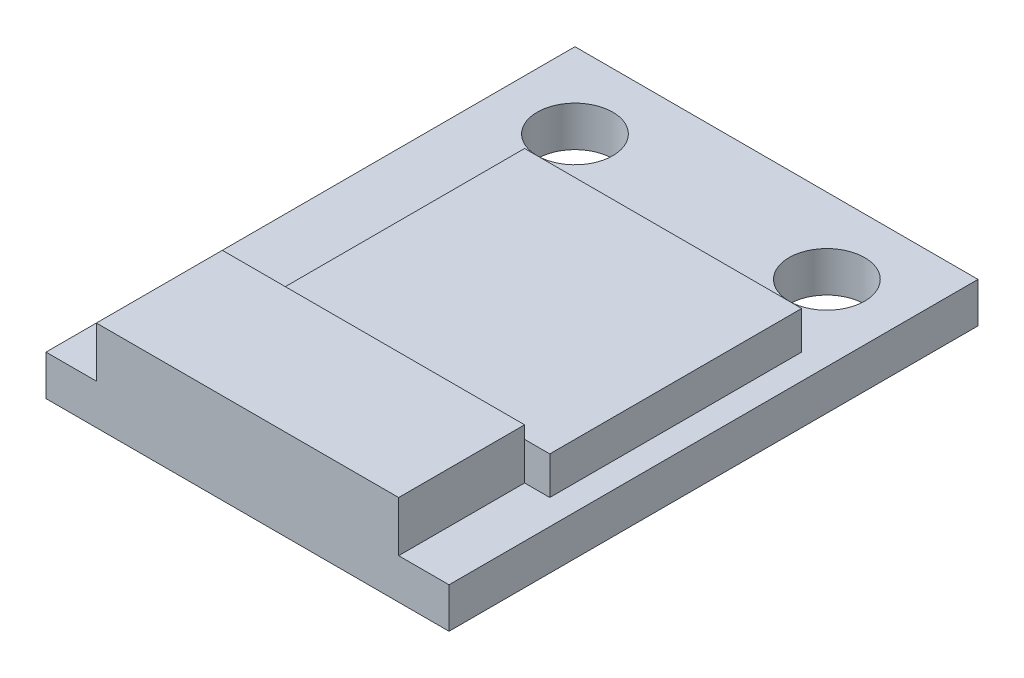
from build123d import *

# Parameters (mm, degrees)
SKETCH1_W           = 16
SKETCH1_H           = 21
SKETCH1_R           = 1.5
BOSS_EXTRUDE1_DEPTH = 1.6
SKETCH2_W           = 11
SKETCH2_H           = 10
BOSS_EXTRUDE2_DEPTH = 1.5
SKETCH3_W           = 12
SKETCH3_H           = 5
BOSS_EXTRUDE3_DEPTH = 2


with BuildPart() as part:
    # Sketch1 → Boss-Extrude1 (new body)
    with BuildSketch(Plane(origin=(0, 0, 0), x_dir=(1, 0, 0), z_dir=(0, 1, 0))):
        with Locations((8, 10.5)):
            Rectangle(SKETCH1_W, SKETCH1_H)
        with Locations(Location((3, 18, 0), (0, 0, 270))):
            Circle(SKETCH1_R, mode=Mode.SUBTRACT)
        with Locations(Location((13, 18, 0), (0, 0, 270))):
            Circle(SKETCH1_R, mode=Mode.SUBTRACT)
    extrude(amount=BOSS_EXTRUDE1_DEPTH)

    # Sketch2 → Boss-Extrude2 (add)
    with BuildSketch(Plane(origin=(0, 1.6, 0), x_dir=(1, 0, 0), z_dir=(0, 1, 0))):
        with Locations((9.5, 10)):
            Rectangle(SKETCH2_W, SKETCH2_H)
    extrude(amount=BOSS_EXTRUDE2_DEPTH)

    # Sketch3 → Boss-Extrude3 (add)
    with BuildSketch(Plane(origin=(0, 1.6, 0), x_dir=(1, 0, 0), z_dir=(0, 1, 0))):
        with Locations((8, 2.5)):
            Rectangle(SKETCH3_W, SKETCH3_H)
    extrude(amount=BOSS_EXTRUDE3_DEPTH)


solid = part.part
